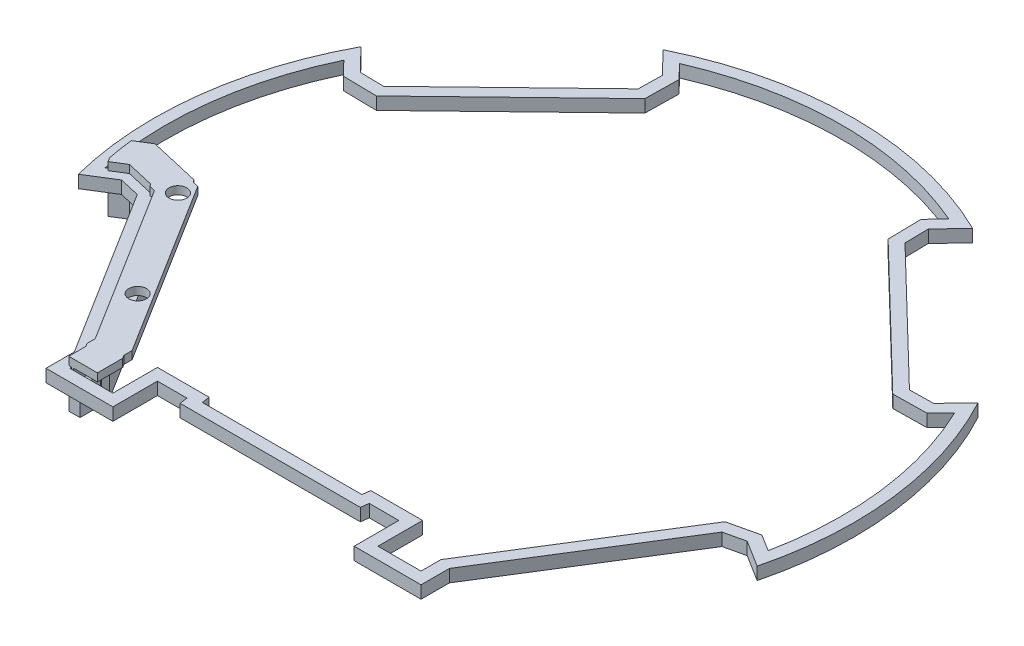
from build123d import *

# Parameters (mm, degrees)
BOSS_EXTRUDE4_DEPTH  = 1.5875
M3_CLEARANCE_HOLE4_D = 2.95
BOSS_EXTRUDE6_DEPTH  = 3.175
BOSS_EXTRUDE7_DEPTH  = 3.175
SKETCH27_R           = 2.25
BOSS_EXTRUDE8_DEPTH  = 2
BOSS_EXTRUDE9_DEPTH  = 10
BOSS_EXTRUDE11_START = -3.2
BOSS_EXTRUDE11_DEPTH = 6.8


with BuildPart() as part:
    # Sketch1 → Boss-Extrude4 (new, symmetric)
    with BuildSketch(Plane(origin=(0, 0, 0), x_dir=(1, 0, 0), z_dir=(0, 1, 0))):
        with BuildLine():
            Line((-62.799553621, 32.496136604), (-73.969425011, 32.691107434))
            Line((-73.969425011, 32.691107434), (-77.053684287, 35.88495141))
            ThreePointArc((-77.053684287, 35.88495141), (-84.36642289, 10.358894189), (-83.446216027, -16.178041625))
            Line((-83.446216027, -16.178041625), (-79.680911643, -13.825218315))
            Line((-79.680911643, -13.825218315), (-69.484649137, -16.179210996))
            Line((-69.484649137, -16.179210996), (-43.894490772, -57.132025032))
            Line((-43.894490772, -57.132025032), (-43.894490772, -64.826600275))
            Line((-43.894490772, -64.826600275), (-43.094490772, -64.826600275))
            Line((-43.094490772, -64.826600275), (-34, -64.826600275))
            Line((-34, -64.826600275), (-34, -55.55))
            Line((-34, -55.55), (-34, -53.55))
            Line((-34, -53.55), (-20, -53.55))
            Line((-20, -53.55), (-19.718918331, -55.55))
            Line((-19.718918331, -55.55), (19.718918331, -55.55))
            Line((19.718918331, -55.55), (20, -53.55))
            Line((20, -53.55), (34, -53.55))
            Line((34, -53.55), (34, -55.55))
            Line((34, -55.55), (34, -64.826600275))
            Line((34, -64.826600275), (43.094490772, -64.826600275))
            Line((43.094490772, -64.826600275), (43.894490772, -64.826600275))
            Line((43.894490772, -64.826600275), (43.894490772, -57.132025032))
            Line((43.894490772, -57.132025032), (69.484649137, -16.179210996))
            Line((69.484649137, -16.179210996), (79.680911643, -13.825218315))
            Line((79.680911643, -13.825218315), (83.446216027, -16.178041625))
            ThreePointArc((83.446216027, -16.178041625), (84.610662337, -8.126242604), (85, 0))
            ThreePointArc((85, 0), (82.98964744, 18.377116688), (77.053684287, 35.88495141))
            Line((77.053684287, 35.88495141), (73.969425011, 32.691107434))
            Line((73.969425011, 32.691107434), (62.799553621, 32.496136604))
            Line((62.799553621, 32.496136604), (30.284668021, 63.895396642))
            Line((30.284668021, 63.895396642), (30.089697191, 75.065268032))
            Line((30.089697191, 75.065268032), (33.173956467, 78.259112008))
            ThreePointArc((33.173956467, 78.259112008), (0, 85), (-33.173956467, 78.259112008))
            Line((-33.173956467, 78.259112008), (-30.089697191, 75.065268032))
            Line((-30.089697191, 75.065268032), (-30.284668021, 63.895396642))
            Line((-30.284668021, 63.895396642), (-62.799553621, 32.496136604))
        make_face()
    extrude(amount=BOSS_EXTRUDE4_DEPTH, both=True)

    # M3 Clearance Hole4 (through all)
    with Locations(Plane(origin=(0, -1.5875, 0), x_dir=(-1, 0, 0), z_dir=(0, -1, 0))):
        with Locations((-67.099301622, -15.278865202), (-50.141885166, -42.416404279), (-61.062544382, 30.698137949), (-38.043670771, 52.927205804), (50.141885166, -42.416404279), (67.099301622, -15.278865202), (38.043670771, 52.927205804), (61.062544382, 30.698137949)):
            Hole(M3_CLEARANCE_HOLE4_D / 2)

    # Sketch22 → Boss-Extrude6 (add)
    with BuildSketch(Plane(origin=(0, 1.5875, 0), x_dir=(1, 0, 0), z_dir=(0, 1, 0))):
        Polygon((-30.780977357, 64.111198083), (-62.997902655, 32.999674963), (-64.553300643, 33.026824536), (-65.061950694, 32.535626892), (-62.799553621, 32.496136604), (-30.284668021, 63.895396642), (-30.245177733, 66.157793715), (-30.753827784, 65.66659607), align=None)
        Polygon((-69.484649137, -16.179210996), (-71.689396914, -15.670204865), (-71.314687409, -16.269865425), (-69.798923312, -16.61980714), (-44.394490772, -57.275397724), (-44.394490772, -59.351185631), (-43.894490772, -60.151352895), (-43.894490772, -57.132025032), align=None)
        Polygon((30.753827784, 65.66659607), (30.245177733, 66.157793715), (30.284668021, 63.895396642), (62.799553621, 32.496136604), (65.061950694, 32.535626892), (64.553300643, 33.026824536), (62.997902655, 32.999674963), (30.780977357, 64.111198083), align=None)
        Polygon((69.798923312, -16.61980714), (71.314687409, -16.269865425), (71.689396914, -15.670204865), (69.484649137, -16.179210996), (43.894490772, -57.132025032), (43.894490772, -60.151352895), (44.394490772, -59.351185631), (44.394490772, -57.275397724), align=None)
    extrude(amount=-BOSS_EXTRUDE6_DEPTH)


with BuildPart() as body_2:
    # Sketch22<3> → Boss-Extrude7 (new body)
    with BuildSketch(Plane(origin=(0, 1.5875, 0), x_dir=(1, 0, 0), z_dir=(0, 1, 0))):
        with BuildLine():
            ThreePointArc((-77.96852441, 41.870743978), (-87.84033442, 10.785436891), (-85.781975773, -21.764710716))
            Line((-85.781975773, -21.764710716), (-79.055649799, -17.561635764))
            Line((-79.055649799, -17.561635764), (-73.889316139, -18.754377871))
            Line((-73.889316139, -18.754377871), (-47.394490772, -61.154961745))
            Line((-47.394490772, -61.154961745), (-47.394490772, -68.326600275))
            Line((-47.394490772, -68.326600275), (-30.5, -68.326600275))
            Line((-30.5, -68.326600275), (-30.5, -57.05))
            Line((-30.5, -57.05), (-23.042503582, -57.05))
            Line((-23.042503582, -57.05), (-22.761421913, -59.05))
            Line((-22.761421913, -59.05), (22.761421913, -59.05))
            Line((22.761421913, -59.05), (23.042503582, -57.05))
            Line((23.042503582, -57.05), (30.5, -57.05))
            Line((30.5, -57.05), (30.5, -68.326600275))
            Line((30.5, -68.326600275), (47.394490772, -68.326600275))
            Line((47.394490772, -68.326600275), (47.394490772, -61.154961745))
            Line((47.394490772, -61.154961745), (73.889316139, -18.754377871))
            Line((73.889316139, -18.754377871), (79.055649799, -17.561635764))
            Line((79.055649799, -17.561635764), (85.781975773, -21.764710716))
            ThreePointArc((85.781975773, -21.764710716), (87.84033442, 10.785436891), (77.96852441, 41.870743978))
            Line((77.96852441, 41.870743978), (72.458814924, 36.165272785))
            Line((72.458814924, 36.165272785), (66.450393936, 36.060395407))
            Line((66.450393936, 36.060395407), (33.719343084, 67.668403802))
            Line((33.719343084, 67.668403802), (33.614465706, 73.67682479))
            Line((33.614465706, 73.67682479), (39.124175192, 79.382295983))
            ThreePointArc((39.124175192, 79.382295983), (0, 88.5), (-39.124175192, 79.382295983))
            Line((-39.124175192, 79.382295983), (-33.614465706, 73.67682479))
            Line((-33.614465706, 73.67682479), (-33.719343084, 67.668403802))
            Line((-33.719343084, 67.668403802), (-66.450393936, 36.060395407))
            Line((-66.450393936, 36.060395407), (-72.458814924, 36.165272785))
            Line((-72.458814924, 36.165272785), (-77.96852441, 41.870743978))
        make_face()
        with BuildLine():
            Line((-73.75362357, 33.18741677), (-65.260299728, 33.039165251))
            Line((-65.260299728, 33.039165251), (-30.741487069, 66.373595156))
            Line((-30.741487069, 66.373595156), (-30.59323555, 74.866918998))
            Line((-30.59323555, 74.866918998), (-34.036959375, 78.43299941))
            ThreePointArc((-34.036959375, 78.43299941), (0, 85.5), (34.036959375, 78.43299941))
            Line((34.036959375, 78.43299941), (30.59323555, 74.866918998))
            Line((30.59323555, 74.866918998), (30.741487069, 66.373595156))
            Line((30.741487069, 66.373595156), (65.260299728, 33.039165251))
            Line((65.260299728, 33.039165251), (73.75362357, 33.18741677))
            Line((73.75362357, 33.18741677), (77.197347395, 36.753497183))
            ThreePointArc((77.197347395, 36.753497183), (84.862695965, 10.419828861), (83.795731966, -16.986032625))
            Line((83.795731966, -16.986032625), (79.591588523, -14.358992237))
            Line((79.591588523, -14.358992237), (72.003671089, -16.110801009))
            Line((72.003671089, -16.110801009), (44.394490772, -60.294725588))
            Line((44.394490772, -60.294725588), (44.394490772, -65.326600275))
            Line((44.394490772, -65.326600275), (33.5, -65.326600275))
            Line((33.5, -65.326600275), (33.5, -54.05))
            Line((33.5, -54.05), (20.434643369, -54.05))
            Line((20.434643369, -54.05), (20.1535617, -56.05))
            Line((20.1535617, -56.05), (-20.1535617, -56.05))
            Line((-20.1535617, -56.05), (-20.434643369, -54.05))
            Line((-20.434643369, -54.05), (-33.5, -54.05))
            Line((-33.5, -54.05), (-33.5, -65.326600275))
            Line((-33.5, -65.326600275), (-44.394490772, -65.326600275))
            Line((-44.394490772, -65.326600275), (-44.394490772, -60.294725588))
            Line((-44.394490772, -60.294725588), (-72.003671089, -16.110801009))
            Line((-72.003671089, -16.110801009), (-79.591588523, -14.358992237))
            Line((-79.591588523, -14.358992237), (-83.795731966, -16.986032625))
            ThreePointArc((-83.795731966, -16.986032625), (-84.862695965, 10.419828861), (-77.197347395, 36.753497183))
            Line((-77.197347395, 36.753497183), (-73.75362357, 33.18741677))
        make_face(mode=Mode.SUBTRACT)
    extrude(amount=-BOSS_EXTRUDE7_DEPTH)


with BuildPart() as body_3:
    # Sketch27 → Boss-Extrude8 (new body)
    # profile 1 of 3: a face of its own
    with BuildSketch(Plane(origin=(0, 1.5875, 0), x_dir=(1, 0, 0), z_dir=(0, 1, 0))):
        with BuildLine():
            Line((-80.752789091, -7.419931261), (-84.441828779, -9.7250991))
            ThreePointArc((-84.441828779, -9.7250991), (-84.006005821, -12.961133671), (-83.446216027, -16.178041625))
            Line((-83.446216027, -16.178041625), (-79.680911643, -13.825218315))
            Line((-79.680911643, -13.825218315), (-71.689396914, -15.670204865))
            Line((-71.689396914, -15.670204865), (-71.314687409, -16.269865425))
            Line((-71.314687409, -16.269865425), (-69.798923312, -16.61980714))
            Line((-69.798923312, -16.61980714), (-44.394490772, -57.275397724))
            Line((-44.394490772, -57.275397724), (-44.394490772, -59.351185631))
            Line((-44.394490772, -59.351185631), (-43.894490772, -60.151352895))
            Line((-43.894490772, -60.151352895), (-43.894490772, -64.826600275))
            Line((-43.894490772, -64.826600275), (-37.894490772, -64.826600275))
            Line((-37.894490772, -64.826600275), (-37.894490772, -58.430880581))
            Line((-37.894490772, -58.430880581), (-38.394490772, -57.630713316))
            Line((-38.394490772, -57.630713316), (-38.394490772, -55.55492541))
            Line((-38.394490772, -55.55492541), (-66.027633212, -11.332653417))
            Line((-66.027633212, -11.332653417), (-67.543397309, -10.982711702))
            Line((-67.543397309, -10.982711702), (-67.918106814, -10.383051142))
            Line((-67.918106814, -10.383051142), (-80.752789091, -7.419931261))
        make_face()
        with Locations(Location((-67.099301622, -15.278865202, 0), (0, 0, 270))):
            Circle(SKETCH27_R, mode=Mode.SUBTRACT)
        with Locations(Location((-50.141885166, -42.416404279, 0), (0, 0, 270))):
            Circle(SKETCH27_R, mode=Mode.SUBTRACT)
    # profile 2 of 3: a face of its own
    with BuildSketch(Plane(origin=(0, 1.5875, 0), x_dir=(1, 0, 0), z_dir=(0, 1, 0))):
        Polygon((-82.783816946, -17.238101746), (-83.446216027, -16.178041625), (-79.680911643, -13.825218315), (-71.689396914, -15.670204865), (-71.314687409, -16.269865425), (-69.798923312, -16.61980714), (-44.394490772, -57.275397724), (-44.394490772, -59.351185631), (-43.894490772, -60.151352895), (-43.894490772, -64.826600275), (-45.144490772, -64.826600275), (-45.144490772, -60.509784627), (-45.644490772, -59.709617363), (-45.644490772, -57.633829457), (-70.58460875, -17.721297499), (-72.100372846, -17.371355784), (-72.475082351, -16.771695224), (-79.457603842, -15.159653118), align=None)
    # profile 3 of 3: a face of its own
    with BuildSketch(Plane(origin=(0, 1.5875, 0), x_dir=(1, 0, 0), z_dir=(0, 1, 0))):
        with BuildLine():
            Line((-43.894490772, -60.151352895), (-43.894490772, -64.826600275))
            Line((-43.894490772, -64.826600275), (-42.294490772, -64.826600275))
            Line((-42.294490772, -64.826600275), (-42.294490772, -59.692560278))
            Line((-42.294490772, -59.692560278), (-42.794490772, -58.892393013))
            Line((-42.794490772, -58.892393013), (-42.794490772, -56.816605107))
            Line((-42.794490772, -56.816605107), (-50.395757216, -44.652035953))
            ThreePointArc((-50.395757216, -44.652035953), (-52.049993383, -43.608722624), (-52.262547786, -41.664546545))
            Line((-52.262547786, -41.664546545), (-67.353173671, -17.514496876))
            ThreePointArc((-67.353173671, -17.514496876), (-68.841190006, -16.703057905), (-69.340802678, -15.08348605))
            Line((-69.340802678, -15.08348605), (-70.309010049, -14.859957765))
            Line((-70.309010049, -14.859957765), (-70.683719554, -14.260297206))
            Line((-70.683719554, -14.260297206), (-79.673649637, -12.184808309))
            Line((-79.673649637, -12.184808309), (-83.717211954, -14.711506473))
            ThreePointArc((-83.717211954, -14.711506473), (-83.584930429, -15.445368404), (-83.446216027, -16.178041625))
            Line((-83.446216027, -16.178041625), (-79.680911643, -13.825218315))
            Line((-79.680911643, -13.825218315), (-71.689396914, -15.670204865))
            Line((-71.689396914, -15.670204865), (-71.314687409, -16.269865425))
            Line((-71.314687409, -16.269865425), (-69.798923312, -16.61980714))
            Line((-69.798923312, -16.61980714), (-44.394490772, -57.275397724))
            Line((-44.394490772, -57.275397724), (-44.394490772, -59.351185631))
            Line((-44.394490772, -59.351185631), (-43.894490772, -60.151352895))
        make_face()
    extrude(amount=BOSS_EXTRUDE8_DEPTH)

    # Sketch27<3> → Boss-Extrude9 (add)
    with BuildSketch(Plane(origin=(0, 1.5875, 0), x_dir=(1, 0, 0), z_dir=(0, 1, 0))):
        Polygon((-82.783816946, -17.238101746), (-83.446216027, -16.178041625), (-79.680911643, -13.825218315), (-71.689396914, -15.670204865), (-71.314687409, -16.269865425), (-69.798923312, -16.61980714), (-44.394490772, -57.275397724), (-44.394490772, -59.351185631), (-43.894490772, -60.151352895), (-43.894490772, -64.826600275), (-45.144490772, -64.826600275), (-45.144490772, -60.509784627), (-45.644490772, -59.709617363), (-45.644490772, -57.633829457), (-70.58460875, -17.721297499), (-72.100372846, -17.371355784), (-72.475082351, -16.771695224), (-79.457603842, -15.159653118), align=None)
    extrude(amount=-BOSS_EXTRUDE9_DEPTH)

    # Sketch27<7> → Boss-Extrude11 (add)
    with BuildSketch(Plane(origin=(0, 1.5875, 0), x_dir=(1, 0, 0), z_dir=(0, 1, 0)).offset(BOSS_EXTRUDE11_START)):
        with BuildLine():
            Line((-43.894490772, -60.151352895), (-43.894490772, -64.826600275))
            Line((-43.894490772, -64.826600275), (-42.294490772, -64.826600275))
            Line((-42.294490772, -64.826600275), (-42.294490772, -59.692560278))
            Line((-42.294490772, -59.692560278), (-42.794490772, -58.892393013))
            Line((-42.794490772, -58.892393013), (-42.794490772, -56.816605107))
            Line((-42.794490772, -56.816605107), (-50.395757216, -44.652035953))
            ThreePointArc((-50.395757216, -44.652035953), (-52.049993383, -43.608722624), (-52.262547786, -41.664546545))
            Line((-52.262547786, -41.664546545), (-67.353173671, -17.514496876))
            ThreePointArc((-67.353173671, -17.514496876), (-68.841190006, -16.703057905), (-69.340802678, -15.08348605))
            Line((-69.340802678, -15.08348605), (-70.309010049, -14.859957765))
            Line((-70.309010049, -14.859957765), (-70.683719554, -14.260297206))
            Line((-70.683719554, -14.260297206), (-79.673649637, -12.184808309))
            Line((-79.673649637, -12.184808309), (-83.717211954, -14.711506473))
            ThreePointArc((-83.717211954, -14.711506473), (-83.584930429, -15.445368404), (-83.446216027, -16.178041625))
            Line((-83.446216027, -16.178041625), (-79.680911643, -13.825218315))
            Line((-79.680911643, -13.825218315), (-71.689396914, -15.670204865))
            Line((-71.689396914, -15.670204865), (-71.314687409, -16.269865425))
            Line((-71.314687409, -16.269865425), (-69.798923312, -16.61980714))
            Line((-69.798923312, -16.61980714), (-44.394490772, -57.275397724))
            Line((-44.394490772, -57.275397724), (-44.394490772, -59.351185631))
            Line((-44.394490772, -59.351185631), (-43.894490772, -60.151352895))
        make_face()
    extrude(amount=-BOSS_EXTRUDE11_DEPTH)


solid = Compound([body_2.part, body_3.part])
